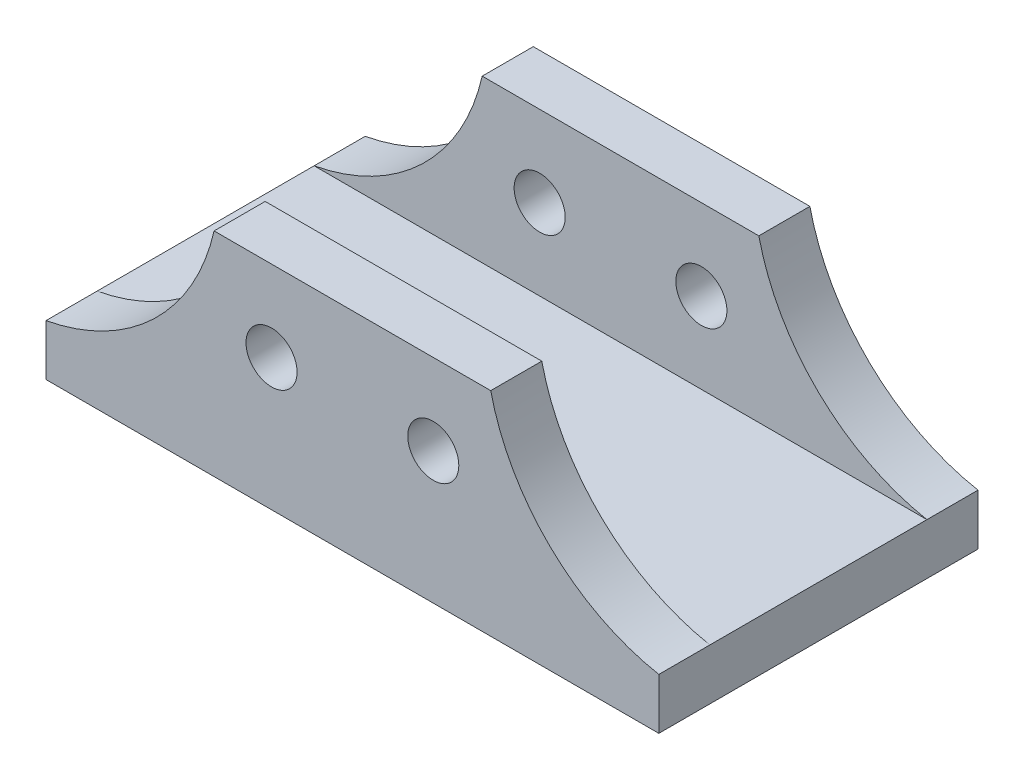
from build123d import *

# Parameters (mm, degrees)
SZKIC1_R                    = 6
DODANIE_WYCI_GNI_CIE1_DEPTH = 12
DODANIE_WYCI_GNI_CIE2_START = -25.5
SZKIC2_W                    = 144
SZKIC2_H                    = 12
DODANIE_WYCI_GNI_CIE2_DEPTH = 51


with BuildPart() as part:
    # Szkic1 → Dodanie-wyciągnięcie1 (new body)
    with BuildSketch(Plane.XY):
        with BuildLine():
            Line((-72, 0), (72, 0))
            Line((72, 0), (72, 12))
            ThreePointArc((72, 12), (46.579087682, 25.10523588), (32.5, 50))
            Line((32.5, 50), (-32.5, 50))
            ThreePointArc((-32.5, 50), (-46.579087682, 25.10523588), (-72, 12))
            Line((-72, 12), (-72, 0))
        make_face()
        with Locations((19, 31)):
            Circle(SZKIC1_R, mode=Mode.SUBTRACT)
        with Locations(Location((-19, 31, 0), (0, 0, 180))):
            Circle(SZKIC1_R, mode=Mode.SUBTRACT)
    extrude(amount=DODANIE_WYCI_GNI_CIE1_DEPTH)


with BuildPart() as body_2:
    # Lustro2: mirrored copy
    add(part.part.mirror(Plane.XY.offset(37.5)))


with BuildPart() as part_1:
    add(part.part)

    add(body_2.part)  # Dodanie-wyciągnięcie2 merges body 2
    # Szkic2 → Dodanie-wyciągnięcie2 (add)
    with BuildSketch(Plane.XY.offset(37.5).offset(DODANIE_WYCI_GNI_CIE2_START)):
        with Locations((0, 6)):
            Rectangle(SZKIC2_W, SZKIC2_H)
    extrude(amount=DODANIE_WYCI_GNI_CIE2_DEPTH)


solid = part_1.part
